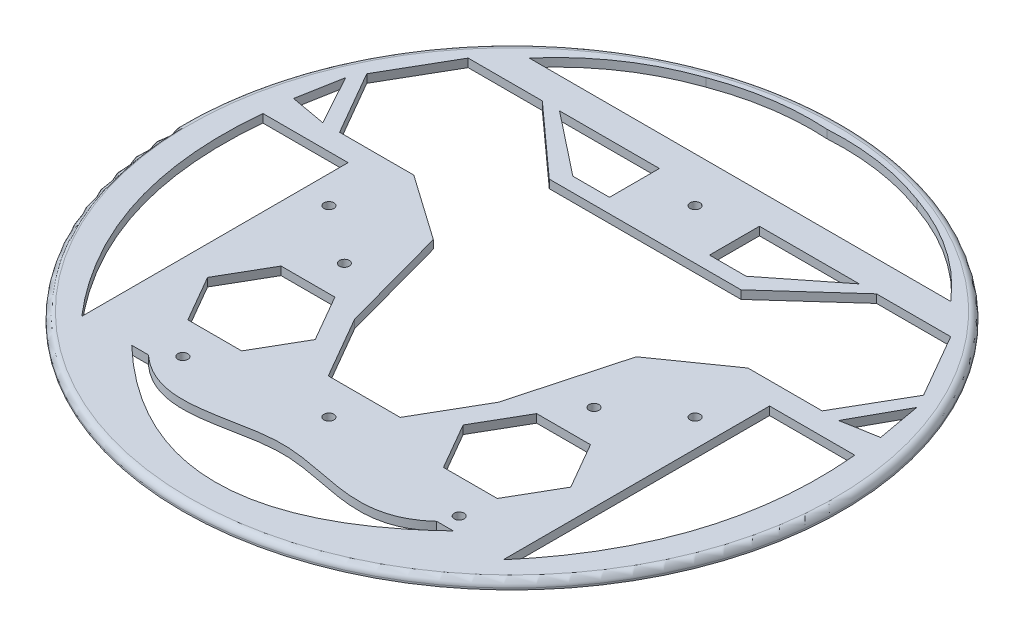
from build123d import *

# Parameters (mm, degrees)
BOSS_EXTRUDE1_DEPTH      = 4
BOSS_EXTRUDE1_DEPTH_BACK = 2.5
SKETCH1_R                = 99
SKETCH3_R                = 1.5
CUT_EXTRUDE2_DEPTH       = 20.5
SKETCH4_R                = 1.5
CUT_EXTRUDE3_DEPTH       = 20.5
CUT_EXTRUDE4_DEPTH       = 10
CUT_EXTRUDE5_DEPTH       = 10
CUT_EXTRUDE6_DEPTH       = 10
BOSS_EXTRUDE4_DEPTH      = 6.5
CUT_EXTRUDE12_DEPTH      = 147.5
CUT_EXTRUDE12_DEPTH_BACK = 90
SKETCH9_W                = 198
SKETCH9_H                = 4
SKETCH15_R               = 1.5
CUT_EXTRUDE13_DEPTH      = 147.5
BOSS_EXTRUDE12_DEPTH     = 2.5
CUT_EXTRUDE14_DEPTH      = 2.5
CUT_EXTRUDE15_DEPTH      = 2.5
BOSS_EXTRUDE14_DEPTH     = 2.5
CUT_EXTRUDE28_DEPTH      = 2.5
CUT_EXTRUDE30_DEPTH      = 2.5
CUT_EXTRUDE31_DEPTH      = 2.5
CUT_EXTRUDE32_DEPTH      = 2.5
CUT_EXTRUDE33_DEPTH      = 2.5
FILLET1_R                = 2


with BuildPart() as part:
    # Sketch1 → Boss-Extrude1 (new, two sides: drawn at the far end of the back side and taken through both)
    with BuildSketch(Plane(origin=(0, 0, 0), x_dir=(1, 0, 0), z_dir=(0, 1, 0)).offset(-BOSS_EXTRUDE1_DEPTH_BACK)):
        with Locations(Location((0, 0, 0), (0, 0, 270))):
            Circle(SKETCH1_R)
    extrude(amount=BOSS_EXTRUDE1_DEPTH + BOSS_EXTRUDE1_DEPTH_BACK)

    # Sketch3 → Cut-Extrude2 (cut)
    with BuildSketch(Plane(origin=(0, 4, 0), x_dir=(1, 0, 0), z_dir=(0, 1, 0))):
        with Locations(Location((-55, 0, 0), (0, 0, 270))):
            Circle(SKETCH3_R)
        with Locations(Location((55, 0, 0), (0, 0, 270))):
            Circle(SKETCH3_R)
        with Locations(Location((0, -55, 0), (0, 0, 270))):
            Circle(SKETCH3_R)
    extrude(amount=-CUT_EXTRUDE2_DEPTH, mode=Mode.SUBTRACT)

    # Sketch4 → Cut-Extrude3 (cut)
    with BuildSketch(Plane(origin=(0, 4, 0), x_dir=(1, 0, 0), z_dir=(0, 1, 0))):
        with Locations(Location((-37.67598398, -12.687109852, 0), (0, 0, 270))):
            Circle(SKETCH4_R)
        with Locations(Location((-37.67598398, -61.187109852, 0), (0, 0, 270))):
            Circle(SKETCH4_R)
        with Locations(Location((45.32401602, -61.187109852, 0), (0, 0, 270))):
            Circle(SKETCH4_R)
        with Locations(Location((37.32401602, -12.687109852, 0), (0, 0, 270))):
            Circle(SKETCH4_R)
    extrude(amount=-CUT_EXTRUDE3_DEPTH, mode=Mode.SUBTRACT)

    # Sketch5 → Cut-Extrude4 (cut)
    with BuildSketch(Plane(origin=(0, 4, 0), x_dir=(1, 0, 0), z_dir=(0, 1, 0))):
        Polygon((28.800278696, 40), (14.400139348, 64.941772986), (-14.400139348, 64.941772986), (-28.800278696, 40), (-14.400139348, 15.058227014), (14.400139348, 15.058227014), align=None)
        Polygon((21.600209022, -25.67229275), (10.800104511, -6.965963011), (-10.800104511, -6.965963011), (-21.600209022, -25.67229275), (-10.800104511, -44.37862249), (10.800104511, -44.37862249), align=None)
        Polygon((83.632371409, 40), (72.485714402, 59.306576271), (50.192400388, 59.306576271), (39.045743381, 40), (50.192400388, 20.693423729), (72.485714402, 20.693423729), align=None)
        Polygon((-39.050278696, 40), (-50.195139348, 59.303464893), (-72.484860652, 59.303464893), (-83.629721304, 40), (-72.484860652, 20.696535107), (-50.195139348, 20.696535107), align=None)
    extrude(amount=-CUT_EXTRUDE4_DEPTH, mode=Mode.SUBTRACT)

    # Sketch6 → Cut-Extrude5 (cut)
    with BuildSketch(Plane(origin=(0, 4, 0), x_dir=(1, 0, 0), z_dir=(0, 1, 0))):
        with BuildLine():
            add(Edge.make_bspline(
                [(-31.654711151, 89.957779093), (-50.388052391, 83.478791384), (-63.309422303, 68.478903242)],
                knots=[0, 0, 0, 1, 1, 1], degree=2))
            Line((-63.309422303, 68.478903242), (0, 68.478903242))
            Line((0, 68.478903242), (0, 89.957779093))
            Line((0, 89.957779093), (-31.654711151, 89.957779093))
        make_face()
        with BuildLine():
            Line((0, 89.957779093), (0, 68.478903242))
            Line((0, 68.478903242), (63.309422303, 68.478903242))
            add(Edge.make_bspline(
                [(31.654711151, 89.957779093), (50.388052391, 83.478791384), (63.309422303, 68.478903242)],
                knots=[0, 0, 0, 1, 1, 1], degree=2))
            Line((31.654711151, 89.957779093), (0, 89.957779093))
        make_face()
        with BuildLine():
            add(Edge.make_bspline(
                [(-31.654711151, 89.957779093), (-16.234373416, 95.698858628), (0, 94.690381395)],
                knots=[0, 0, 0, 1, 1, 1], degree=2))
            Line((-31.654711151, 89.957779093), (0, 89.957779093))
            Line((0, 89.957779093), (0, 94.690381395))
        make_face()
        with BuildLine():
            Line((0, 94.690381395), (0, 89.957779093))
            Line((0, 89.957779093), (31.654711151, 89.957779093))
            add(Edge.make_bspline(
                [(31.654711151, 89.957779093), (16.234373416, 95.698858628), (0, 94.690381395)],
                knots=[0, 0, 0, 1, 1, 1], degree=2))
        make_face()
    extrude(amount=-CUT_EXTRUDE5_DEPTH, mode=Mode.SUBTRACT)

    # Sketch7 → Cut-Extrude6 (cut)
    with BuildSketch(Plane(origin=(0, 4, 0), x_dir=(1, 0, 0), z_dir=(0, 1, 0))):
        with BuildLine():
            Line((-75.473576138, -25.936867131), (-63.309422303, -25.936867131))
            Line((-63.309422303, -25.936867131), (-63.309422303, 14.063132869))
            Line((-63.309422303, 14.063132869), (-88.897300533, 14.063132869))
            add(Edge.make_bspline(
                [(-88.897300533, 14.063132869), (-90.933307094, -7.078529926), (-85.473576138, -25.936867131)],
                knots=[0, 0, 0, 0.467488594, 0.467488594, 0.467488594], degree=2))
            Line((-85.473576138, -25.936867131), (-75.473576138, -25.936867131))
        make_face()
        with BuildLine():
            add(Edge.make_bspline(
                [(-85.473576138, -25.936867131), (-79.254453264, -47.418203342), (-63.309422303, -65.936867131)],
                knots=[0.467488594, 0.467488594, 0.467488594, 1, 1, 1], degree=2))
            Line((-63.309422303, -65.936867131), (-63.309422303, -25.936867131))
            Line((-63.309422303, -25.936867131), (-75.473576138, -25.936867131))
            Line((-75.473576138, -25.936867131), (-85.473576138, -25.936867131))
        make_face()
        with BuildLine():
            add(Edge.make_bspline(
                [(88.897300533, 14.063132869), (93.252501041, -31.160778622), (63.309422303, -65.936867131)],
                knots=[0, 0, 0, 1, 1, 1], degree=2))
            Line((63.309422303, -65.936867131), (63.309422303, 14.063132869))
            Line((63.309422303, 14.063132869), (88.897300533, 14.063132869))
        make_face()
    extrude(amount=-CUT_EXTRUDE6_DEPTH, mode=Mode.SUBTRACT)

    # Sketch8 → Boss-Extrude4 (add)
    with BuildSketch(Plane(origin=(0, 4, 0), x_dir=(1, 0, 0), z_dir=(0, 1, 0))):
        Polygon((14.400139348, 64.941772986), (-14.400139348, 64.941772986), (-28.800278696, 40), (0, 40), (28.800278696, 40), align=None)
    extrude(amount=-BOSS_EXTRUDE4_DEPTH)

    # Sketch9 → Cut-Extrude12 (cut, two sides: drawn at the far end of the back side and taken through both)
    with BuildSketch(Plane.XY.offset(-14.063132869).offset(-CUT_EXTRUDE12_DEPTH_BACK)):
        with Locations((0, -0.5)):
            Rectangle(SKETCH9_W, SKETCH9_H)
    extrude(amount=CUT_EXTRUDE12_DEPTH + CUT_EXTRUDE12_DEPTH_BACK, mode=Mode.SUBTRACT)

    # Sketch15 → Cut-Extrude13 (cut)
    with BuildSketch(Plane(origin=(0, 4, 0), x_dir=(1, 0, 0), z_dir=(0, 1, 0))):
        with Locations(Location((0, 55, 0), (0, 0, 270))):
            Circle(SKETCH15_R)
    extrude(amount=-CUT_EXTRUDE13_DEPTH, mode=Mode.SUBTRACT)

    # Sketch16 → Boss-Extrude12 (add)
    with BuildSketch(Plane(origin=(0, 4, 0), x_dir=(1, 0, 0), z_dir=(0, 1, 0))):
        Polygon((-43.18, 47.15288712), (-43.18, 32.84711288), (-39.050278696, 40), align=None)
        Polygon((43.18, 47.160742516), (43.18, 32.839257484), (50.192400388, 20.693423729), (50.192400388, 59.306576271), align=None)
        Polygon((39.045743381, 40), (43.18, 32.839257484), (43.18, 47.160742516), align=None)
        Polygon((-50.195139348, 59.303464893), (-50.195139348, 20.696535107), (-39.050278696, 40), align=None)
    extrude(amount=-BOSS_EXTRUDE12_DEPTH)

    # Sketch17 → Cut-Extrude14 (cut)
    with BuildSketch(Plane(origin=(0, 4, 0), x_dir=(1, 0, 0), z_dir=(0, 1, 0))):
        Polygon((-46.472442717, -50.896241942), (-30.30663518, -50.896241942), (-22.223731411, -36.896241942), (-30.30663518, -22.896241942), (-46.472442717, -22.896241942), (-54.555346486, -36.896241942), align=None)
        Polygon((22.223731411, -36.896241942), (30.30663518, -22.896241942), (46.472442717, -22.896241942), (54.555346486, -36.896241942), (46.472442717, -50.896241942), (30.30663518, -50.896241942), align=None)
    extrude(amount=-CUT_EXTRUDE14_DEPTH, mode=Mode.SUBTRACT)

    # Sketch18 → Cut-Extrude15 (cut)
    with BuildSketch(Plane(origin=(0, 4, 0), x_dir=(1, 0, 0), z_dir=(0, 1, 0))):
        with BuildLine():
            Line((-23.550738761, -72.283664778), (-28.452320168, -81))
            add(Edge.make_bspline(
                [(-28.452320168, -81), (-14.226160084, -89), (0, -89)],
                knots=[0.205519971, 0.205519971, 0.205519971, 0.5, 0.5, 0.5], degree=2))
            Line((0, -89), (0, -69))
            add(Edge.make_bspline(
                [(-23.550738761, -72.283664778), (-15.813437997, -71.682250906), (-7.906718999, -69), (0, -69)],
                knots=[0.233014595, 0.233014595, 0.233014595, 0.233014595, 0.5, 0.5, 0.5, 0.5], degree=3))
        make_face()
        with BuildLine():
            Line((-43.309422303, -65.936867131), (-48.309422303, -65.936867131))
            add(Edge.make_bspline(
                [(-48.309422303, -65.936867131), (-38.380871236, -75.416735924), (-28.452320168, -81)],
                knots=[0, 0, 0, 0.205519971, 0.205519971, 0.205519971], degree=2))
            Line((-28.452320168, -81), (-23.550738761, -72.283664778))
            add(Edge.make_bspline(
                [(-43.309422303, -65.936867131), (-36.927327916, -71.748446546), (-30.30355735, -72.80855568), (-23.550738761, -72.283664778)],
                knots=[0, 0, 0, 0, 0.233014595, 0.233014595, 0.233014595, 0.233014595], degree=3))
        make_face()
        with BuildLine():
            Line((0, -69), (0, -89))
            add(Edge.make_bspline(
                [(0, -89), (14.226160084, -89), (28.452320168, -81)],
                knots=[0.5, 0.5, 0.5, 0.794480029, 0.794480029, 0.794480029], degree=2))
            Line((28.452320168, -81), (23.550738761, -72.283664778))
            add(Edge.make_bspline(
                [(0, -69), (7.906718999, -69), (15.813437997, -71.682250906), (23.550738761, -72.283664778)],
                knots=[0.5, 0.5, 0.5, 0.5, 0.766985405, 0.766985405, 0.766985405, 0.766985405], degree=3))
        make_face()
        with BuildLine():
            Line((23.550738761, -72.283664778), (28.452320168, -81))
            add(Edge.make_bspline(
                [(28.452320168, -81), (38.380871236, -75.416735924), (48.309422303, -65.936867131)],
                knots=[0.794480029, 0.794480029, 0.794480029, 1, 1, 1], degree=2))
            Line((48.309422303, -65.936867131), (43.309422303, -65.936867131))
            add(Edge.make_bspline(
                [(23.550738761, -72.283664778), (30.30355735, -72.80855568), (36.927327916, -71.748446546), (43.309422303, -65.936867131)],
                knots=[0.766985405, 0.766985405, 0.766985405, 0.766985405, 1, 1, 1, 1], degree=3))
        make_face()
    extrude(amount=-CUT_EXTRUDE15_DEPTH, mode=Mode.SUBTRACT)

    # Sketch19 → Boss-Extrude14 (add)
    with BuildSketch(Plane(origin=(0, 4, 0), x_dir=(1, 0, 0), z_dir=(0, 1, 0))):
        Polygon((-10.800104511, -6.965963011), (-30.30663518, -22.896241942), (-14.400139348, 15.058227014), (14.400139348, 15.058227014), (30.30663518, -22.896241942), (10.800104511, -6.965963011), align=None)
    extrude(amount=-BOSS_EXTRUDE14_DEPTH)

    # Sketch20 → Cut-Extrude28 (cut)
    with BuildSketch(Plane(origin=(0, 4, 0), x_dir=(1, 0, 0), z_dir=(0, 1, 0))):
        Polygon((-28.800278696, 40), (-10.800104511, -6.965963011), (10.800104511, -6.965963011), (28.800278696, 40), (14.400139348, 15.058227014), (-14.400139348, 15.058227014), align=None)
    extrude(amount=-CUT_EXTRUDE28_DEPTH, mode=Mode.SUBTRACT)

    # Sketch24 → Cut-Extrude30 (cut)
    with BuildSketch(Plane(origin=(0, 4, 0), x_dir=(1, 0, 0), z_dir=(0, 1, 0))):
        Polygon((-50.195139348, 20.696535107), (-50.195139348, 59.303464893), (-28.800278696, 40), (-10.800104511, -6.965963011), align=None)
        Polygon((10.800104511, -6.965963011), (28.800278696, 40), (50.192400388, 59.306576271), (50.192400388, 20.693423729), align=None)
    extrude(amount=-CUT_EXTRUDE30_DEPTH, mode=Mode.SUBTRACT)

    # Sketch25 → Cut-Extrude31 (cut)
    with BuildSketch(Plane(origin=(0, 4, 0), x_dir=(1, 0, 0), z_dir=(0, 1, 0))):
        Polygon((-26.02741996, 44.303464893), (-45.02741996, 59.303464893), (-15.02741996, 59.303464893), (-15.02741996, 44.303464893), align=None)
        Polygon((15.02741996, 44.303464893), (26.02741996, 44.303464893), (45.02741996, 59.303464893), (15.02741996, 59.303464893), align=None)
    extrude(amount=-CUT_EXTRUDE31_DEPTH, mode=Mode.SUBTRACT)

    # Sketch26 → Cut-Extrude32 (cut)
    with BuildSketch(Plane(origin=(0, 4, 0), x_dir=(1, 0, 0), z_dir=(0, 1, 0))):
        Polygon((-21.600209022, -25.67229275), (-30.497621929, 6.865286048), (30.496252449, 6.863730359), (21.600209022, -25.67229275), align=None)
    extrude(amount=-CUT_EXTRUDE32_DEPTH, mode=Mode.SUBTRACT)

    # Sketch27 → Cut-Extrude33 (cut)
    with BuildSketch(Plane(origin=(0, 4, 0), x_dir=(1, 0, 0), z_dir=(0, 1, 0))):
        Polygon((-88.173481573, 22.569049832), (-85.791103644, 35.80448277), (-77.455908988, 20.639886767), align=None)
        Polygon((85.791103644, 35.80448277), (77.455908988, 20.639886767), (88.173481573, 22.569049832), align=None)
    extrude(amount=-CUT_EXTRUDE33_DEPTH, mode=Mode.SUBTRACT)

    # Fillet1
    fillet1_edges = [part.edges().sort_by_distance(p)[0] for p in [
        (0, 4, -99),
    ]]
    fillet(fillet1_edges, radius=FILLET1_R)


solid = part.part
